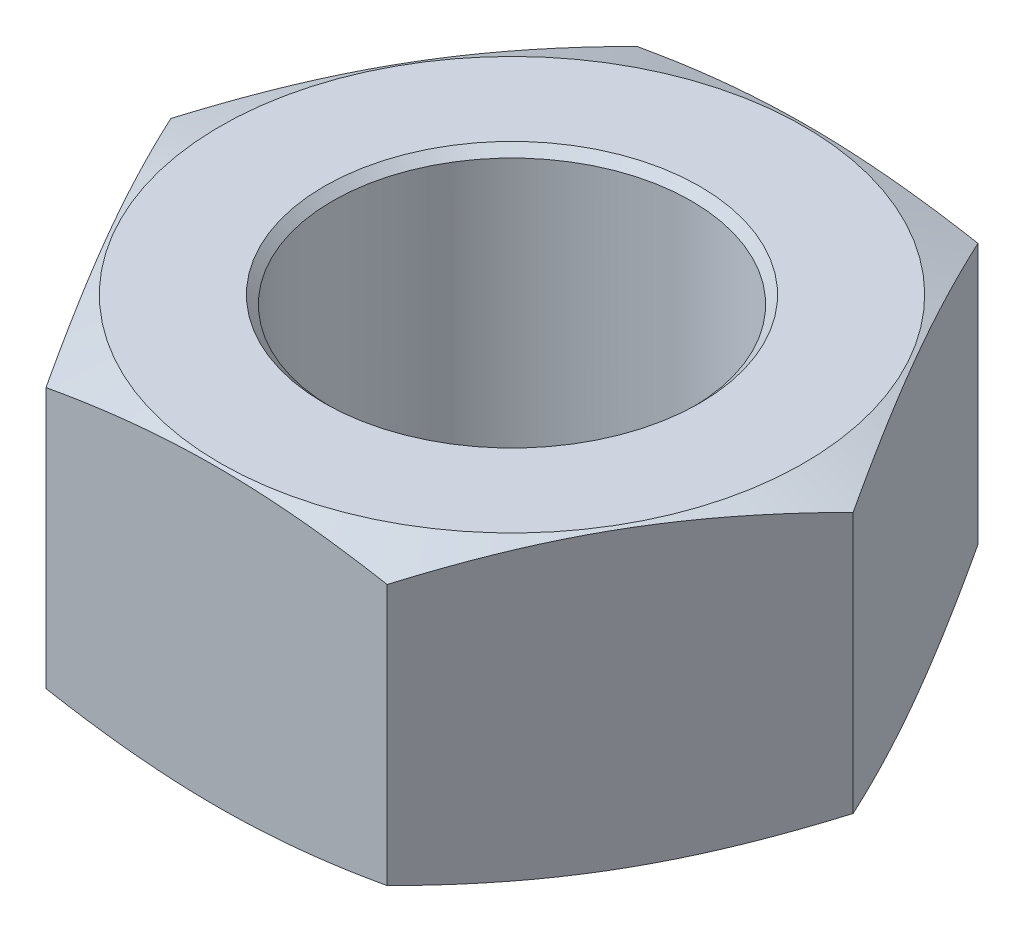
from build123d import *

# Parameters (mm, degrees)
RESSALTO_EXTRUS_O2_DEPTH         = 7
FURO_ROSCADO_DE_M101_D           = 8.5
FURO_ROSCADO_DE_M101_CSINK_D     = 10.05
FURO_ROSCADO_DE_M101_CSINK_ANGLE = 90
CHANFRO2_SIZE                    = 0.2
ESBO_O5_OUTSIDE_W                = 94.1
ESBO_O5_OUTSIDE_H                = 91.934
ESBO_O5_OUTSIDE_R                = 6.914339911
CORTE_EXTRUS_O1_DEPTH            = 13
CORTE_EXTRUS_O1_DRAFT            = -70
ESBO_O6_OUTSIDE_W                = 94.1
ESBO_O6_OUTSIDE_H                = 91.934
ESBO_O6_OUTSIDE_R                = 6.994841317
CORTE_EXTRUS_O2_DEPTH            = 13
CORTE_EXTRUS_O2_DRAFT            = -70


with BuildPart() as part:
    # Esboço1 → Ressalto-extrusão2 (new body)
    with BuildSketch(Plane(origin=(0, 0, 0), x_dir=(1, 0, 0), z_dir=(0, 1, 0))):
        Polygon((4.041451884, 7), (-4.041451884, 7), (-8.082903769, 0), (-4.041451884, -7), (4.041451884, -7), (8.082903769, 0), align=None)
    extrude(amount=RESSALTO_EXTRUS_O2_DEPTH)

    # Furo roscado de M101 (through all)
    with Locations(Plane(origin=(0, 0, 0), x_dir=(-1, 0, 0), z_dir=(0, -1, 0))):
        with Locations((0, 0)):
            CounterSinkHole(FURO_ROSCADO_DE_M101_D / 2, FURO_ROSCADO_DE_M101_CSINK_D / 2, counter_sink_angle=FURO_ROSCADO_DE_M101_CSINK_ANGLE)

    # Chanfro2
    chanfro2_edges = [part.edges().sort_by_distance(p)[0] for p in [
        (-4.25, 7, 0),
    ]]
    chamfer(chanfro2_edges, length=CHANFRO2_SIZE)


with BuildPart() as corte_extrus_o1_tool:
    # Esboço5 outside → Corte-extrusão1 (with draft: the straight prism first)
    with BuildSketch(Plane(origin=(0, 7, 0), x_dir=(1, 0, 0), z_dir=(0, 1, 0))):
        Rectangle(ESBO_O5_OUTSIDE_W, ESBO_O5_OUTSIDE_H)
        Circle(ESBO_O5_OUTSIDE_R, mode=Mode.SUBTRACT)
    extrude(amount=-CORTE_EXTRUS_O1_DEPTH)
    # Corte-extrusão1: the draft: its side faces are tilted about the plane it starts from
    corte_extrus_o1_sides = [corte_extrus_o1_tool.faces().sort_by_distance(p)[0] for p in [
        (0, 0.5, 45.967),
        (47.05, 0.5, 0),
        (0, 0.5, -45.967),
        (-47.05, 0.5, 0),
        (-6.914339911, 0.5, 0),
    ]]
    draft(corte_extrus_o1_sides, Plane(origin=(0, 7, 0), x_dir=(1, 0, 0), z_dir=(0, 1, 0)), CORTE_EXTRUS_O1_DRAFT)


with BuildPart() as part_1:
    add(part.part)

    # Corte-extrusão1: cut by corte_extrus_o1_tool
    add(corte_extrus_o1_tool.part, mode=Mode.SUBTRACT)


with BuildPart() as corte_extrus_o2_tool:
    # Esboço6 outside → Corte-extrusão2 (with draft: the straight prism first)
    with BuildSketch(Plane.XZ):
        Rectangle(ESBO_O6_OUTSIDE_W, ESBO_O6_OUTSIDE_H)
        Circle(ESBO_O6_OUTSIDE_R, mode=Mode.SUBTRACT)
    extrude(amount=-CORTE_EXTRUS_O2_DEPTH)
    # Corte-extrusão2: the draft: its side faces are tilted about the plane it starts from
    corte_extrus_o2_sides = [corte_extrus_o2_tool.faces().sort_by_distance(p)[0] for p in [
        (0, 6.5, -45.967),
        (47.05, 6.5, 0),
        (0, 6.5, 45.967),
        (-47.05, 6.5, 0),
        (-6.994841317, 6.5, 0),
    ]]
    draft(corte_extrus_o2_sides, Plane.XZ, CORTE_EXTRUS_O2_DRAFT)


with BuildPart() as part_2:
    add(part_1.part)

    # Corte-extrusão2: cut by corte_extrus_o2_tool
    add(corte_extrus_o2_tool.part, mode=Mode.SUBTRACT)


solid = part_2.part
